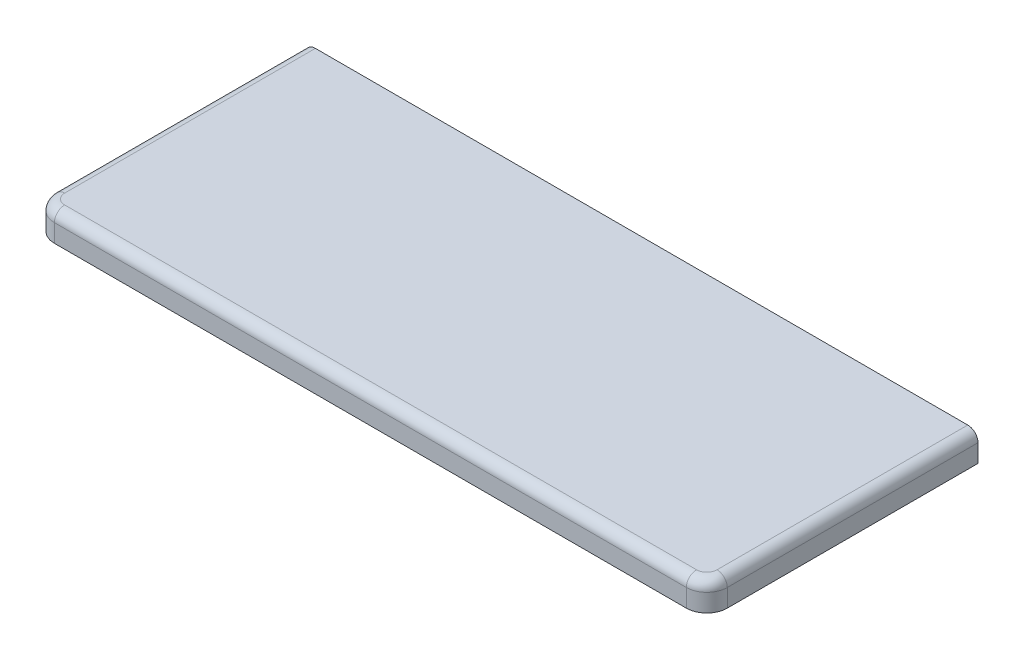
from build123d import *

# Parameters (mm, degrees)
SKETCH1_W           = 65.75
SKETCH1_H           = 38
BOSS_EXTRUDE1_DEPTH = 2.75
SKETCH3_W           = 65.75
SKETCH3_H           = 11.5
CUT_EXTRUDE1_DEPTH  = 39.070042356
FILLET1_R           = 2
FILLET2_R           = 1


with BuildPart() as part:
    # Sketch1 → Boss-Extrude1 (new body)
    with BuildSketch(Plane(origin=(0, 0, 0), x_dir=(1, 0, 0), z_dir=(0, 1, 0))):
        Rectangle(SKETCH1_W, SKETCH1_H)
    extrude(amount=BOSS_EXTRUDE1_DEPTH)

    # Sketch3 → Cut-Extrude1 (cut, through all)
    with BuildSketch(Plane(origin=(0, 2.75, 0), x_dir=(1, 0, 0), z_dir=(0, 1, 0))):
        with Locations((0, 13.25)):
            Rectangle(SKETCH3_W, SKETCH3_H)
    extrude(amount=-CUT_EXTRUDE1_DEPTH, mode=Mode.SUBTRACT)

    # Fillet1
    fillet1_edges = [part.edges().sort_by_distance(p)[0] for p in [
        (32.875, 1.375, 19),
        (-32.875, 1.375, 19),
    ]]
    fillet(fillet1_edges, radius=FILLET1_R)

    # Fillet2
    fillet2_edges = [part.edges().sort_by_distance(p)[0] for p in [
        (-32.875, 2.75, 4.75),
        (0, 2.75, 19),
        (32.875, 2.75, 4.75),
        (32.289213562, 2.75, 18.414213562),
        (-32.289213562, 2.75, 18.414213562),
    ]]
    fillet(fillet2_edges, radius=FILLET2_R)


solid = part.part
